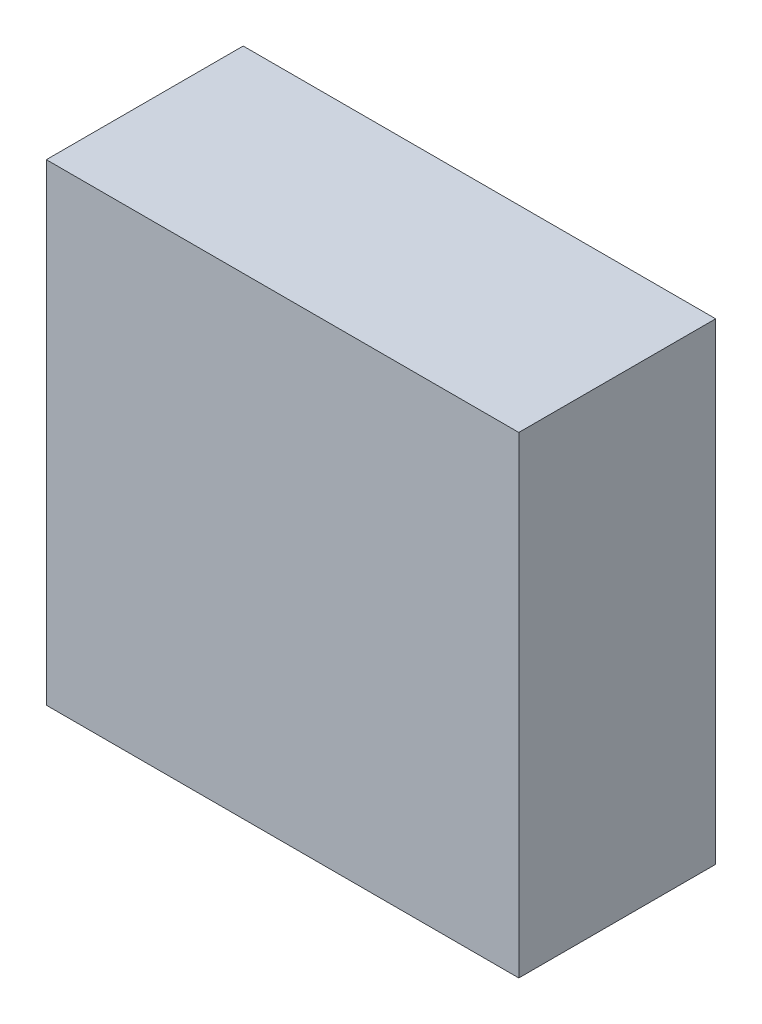
from build123d import *

# Parameters (mm, degrees)
SKETCH1_W           = 12
SKETCH1_H           = 12
BOSS_EXTRUDE1_DEPTH = 5


with BuildPart() as part:
    # Sketch1 → Boss-Extrude1 (new body)
    with BuildSketch(Plane.XY):
        Rectangle(SKETCH1_W, SKETCH1_H)
    extrude(amount=BOSS_EXTRUDE1_DEPTH)


solid = part.part
